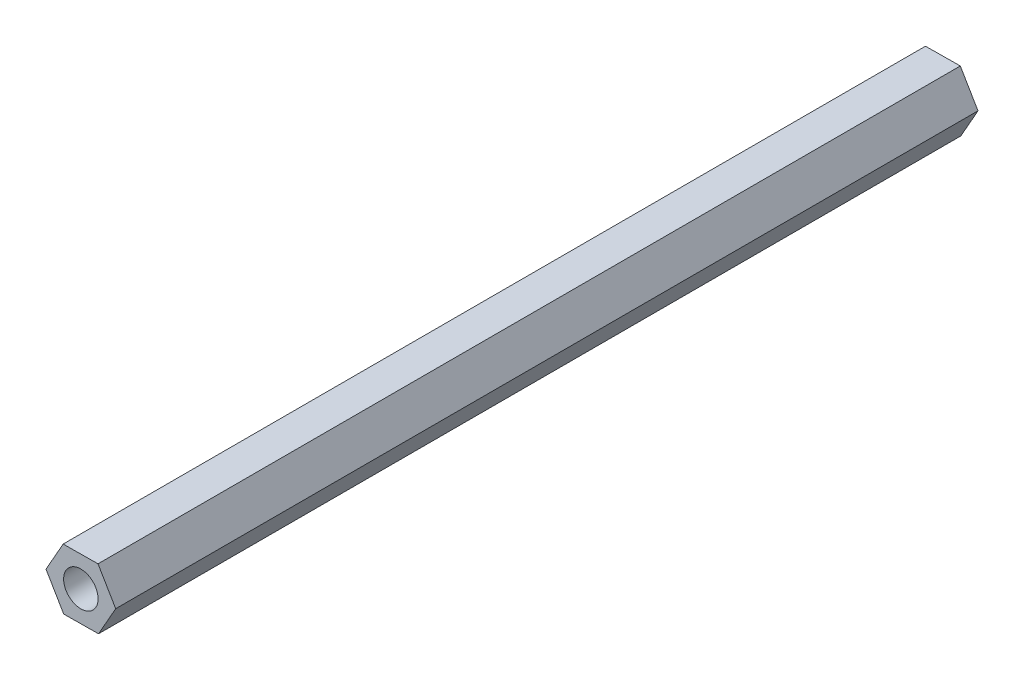
from build123d import *

# Parameters (mm, degrees)
SKETCH_1_R      = 2
EXTRUDE_1_DEPTH = 100


with BuildPart() as part:
    # 草图1 → 凸台-拉伸1 (new body)
    with BuildSketch(Plane.XY):
        Polygon((2.051456248, -3.482077052), (4.041295309, 0.035574699), (1.989839061, 3.517651751), (-2.051456248, 3.482077052), (-4.041295309, -0.035574699), (-1.989839061, -3.517651751), align=None)
        Circle(SKETCH_1_R, mode=Mode.SUBTRACT)
    extrude(amount=EXTRUDE_1_DEPTH)


solid = part.part
